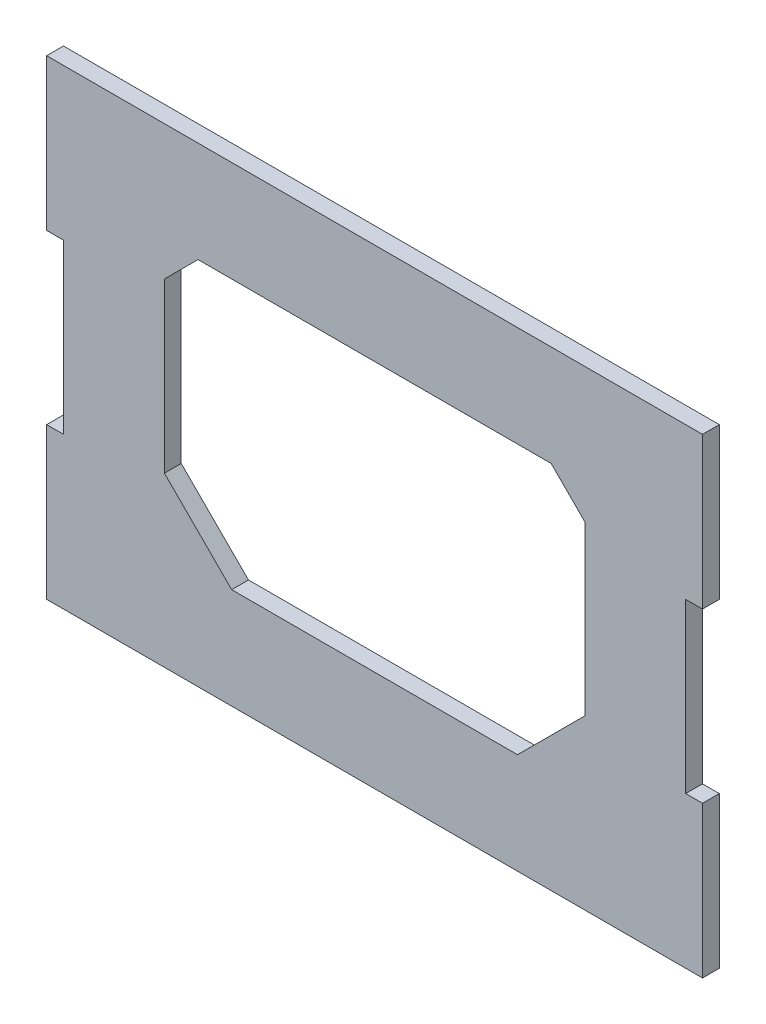
from build123d import *

# Parameters (mm, degrees)
BOSS_EXTRU_2_DEPTH      = 10
ENL_V_MAT_EXTRU_1_DEPTH = 10


with BuildPart() as part:
    # Esquisse1 → Boss.-Extru.2 (new body)
    with BuildSketch(Plane.XY):
        Polygon((0, 0), (390, 0), (390, 90), (380, 90), (380, 190), (390, 190), (390, 280), (0, 280), (0, 190), (10, 190), (10, 90), (0, 90), align=None)
    extrude(amount=BOSS_EXTRU_2_DEPTH)

    # Esquisse3 → Enlèv. mat.-Extru.1 (cut)
    with BuildSketch(Plane.XY.offset(10)):
        Polygon((70, 100), (110, 60), (280, 60), (320, 100), (320, 200), (300, 220), (90, 220), (70, 200), align=None)
    extrude(amount=-ENL_V_MAT_EXTRU_1_DEPTH, mode=Mode.SUBTRACT)


solid = part.part
